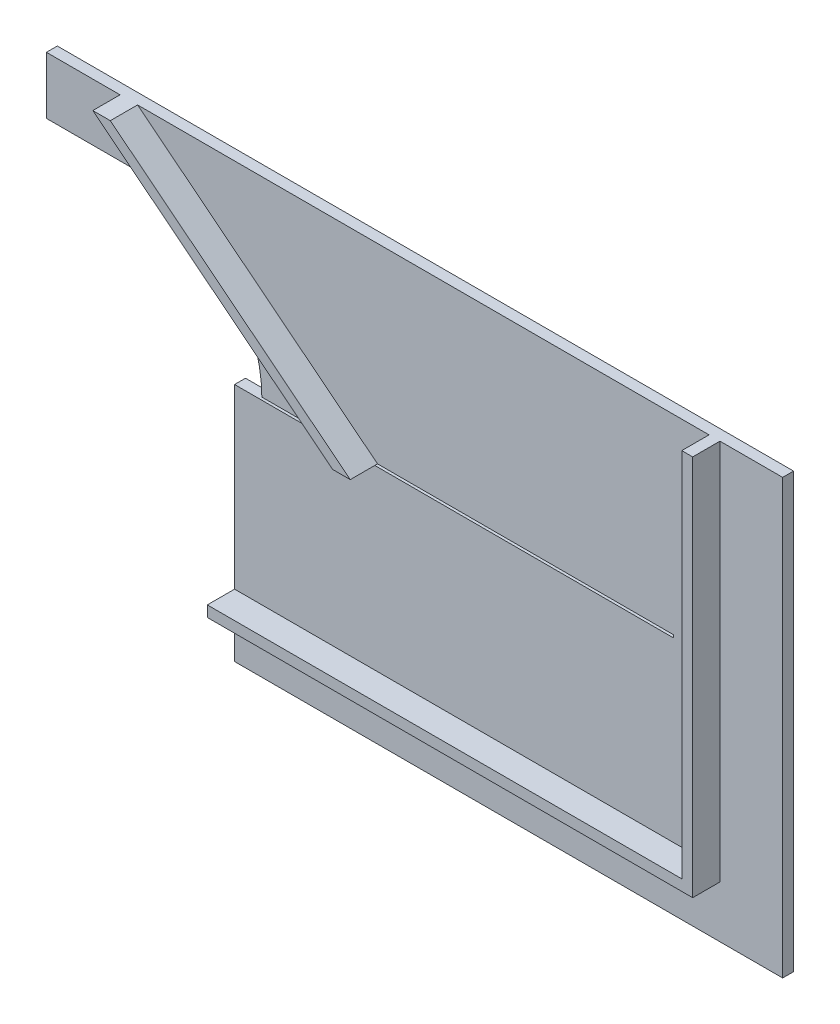
from build123d import *

# Parameters (mm, degrees)
BOSS_EXTRUDE1_DEPTH = 4
BOSS_EXTRUDE2_DEPTH = 10


with BuildPart() as part:
    # Sketch1 → Boss-Extrude1 (new body)
    with BuildSketch(Plane.XY):
        with BuildLine():
            Line((270, 0), (0, 0))
            Line((0, 0), (0, -21))
            Line((0, -21), (30, -21))
            ThreePointArc((30, -21), (64.648232278, -35.351767722), (79, -70))
            Line((79, -70), (230, -70))
            Line((230, -70), (270, -70))
            Line((270, -70), (270, 0))
        make_face()
        Polygon((270, -159), (270, -70), (230, -70), (230, -71), (69, -71), (69, -159), align=None)
    extrude(amount=-BOSS_EXTRUDE1_DEPTH)

    # Sketch2 → Boss-Extrude2 (add)
    with BuildSketch(Plane.XY):
        Polygon((247, 0), (247, -140), (69, -140), (69, -136), (243, -136), (243, 0), align=None)
        Polygon((115, -70), (27, 0), (33.425459564, 0), (117.490094263, -66.869595783), (121.425459564, -70), align=None)
    extrude(amount=BOSS_EXTRUDE2_DEPTH)


solid = part.part
